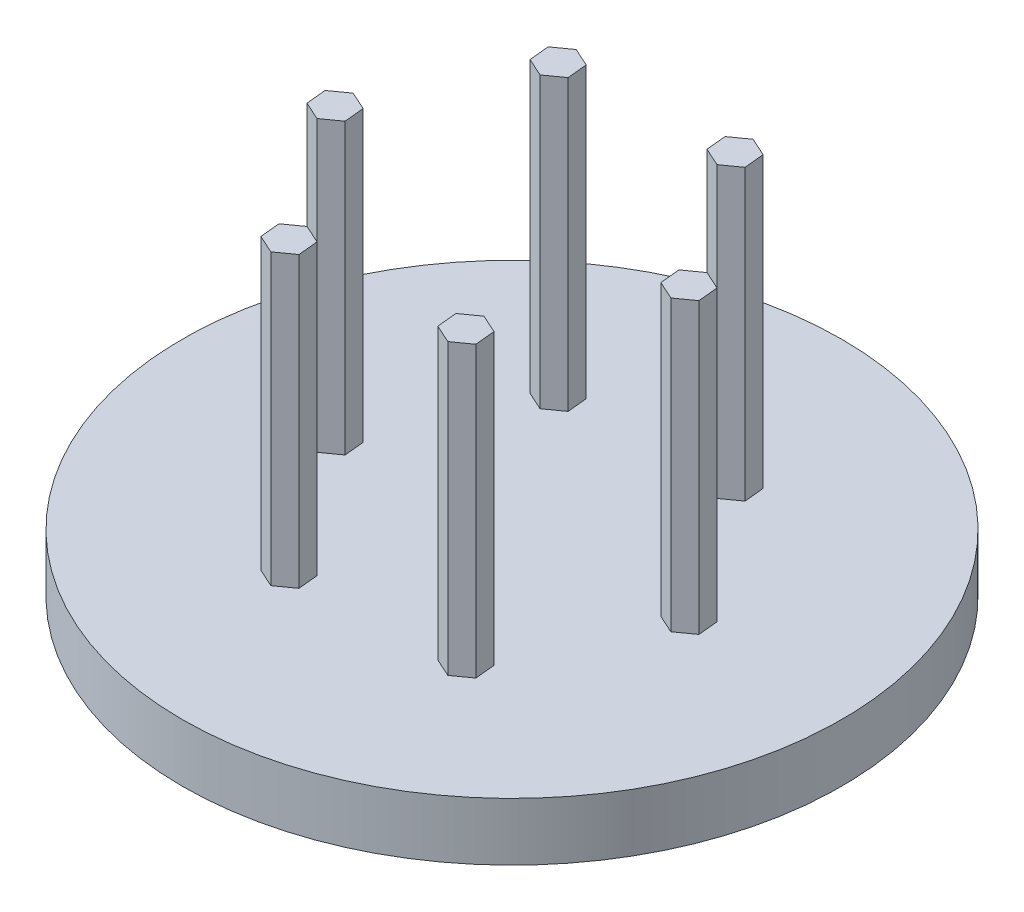
from build123d import *

# Parameters (mm, degrees)
EXTRUDE_1_DEPTH   = 25
EXTRUDE_1_2_DEPTH = 25
EXTRUDE_1_3_DEPTH = 25
EXTRUDE_1_4_DEPTH = 25
EXTRUDE_1_5_DEPTH = 25
EXTRUDE_1_6_DEPTH = 25
SKETCH_2_R        = 28.5
EXTRUDE_2_DEPTH   = 5
EXTRUDE_4_DEPTH   = 5


with BuildPart() as part:
    # 草图1 → 凸台-拉伸1 (new body)
    with BuildSketch(Plane(origin=(0, 0, 0), x_dir=(1, 0, 0), z_dir=(0, 1, 0))):
        Polygon((4.794019272, 13.629956631), (4.962963937, 11.898177863), (6.547200676, 11.178598851), (7.96249275, 12.190798607), (7.793548085, 13.922577374), (6.209311346, 14.642156386), align=None)
    extrude(amount=EXTRUDE_1_DEPTH)



with BuildPart() as body_2:
    # 草图1 → Extrude 1 2 (new body)
    with BuildSketch(Plane(origin=(0, 0, 0), x_dir=(1, 0, 0), z_dir=(0, 1, 0))):
        Polygon((15.954079735, 0.21187806), (15.78513507, 1.943656828), (14.200898331, 2.66323584), (12.785606257, 1.651036084), (12.954550922, -0.080742684), (14.538787661, -0.800321696), align=None)
    extrude(amount=EXTRUDE_1_2_DEPTH)


with BuildPart() as body_3:
    # 草图1 → Extrude 1 3 (new body)
    with BuildSketch(Plane(origin=(0, 0, 0), x_dir=(1, 0, 0), z_dir=(0, 1, 0))):
        Polygon((8.16053165, -13.710699314), (9.575823724, -12.698499559), (9.406879059, -10.966720791), (7.82264232, -10.247141779), (6.407350246, -11.259341535), (6.576294911, -12.991120302), align=None)
    extrude(amount=EXTRUDE_1_3_DEPTH)


with BuildPart() as body_4:
    # 草图1 → Extrude 1 4 (new body)
    with BuildSketch(Plane(origin=(0, 0, 0), x_dir=(1, 0, 0), z_dir=(0, 1, 0))):
        Polygon((-7.793548085, -13.922577374), (-6.209311346, -14.642156386), (-4.794019272, -13.629956631), (-4.962963937, -11.898177863), (-6.547200676, -11.178598851), (-7.96249275, -12.190798607), align=None)
    extrude(amount=EXTRUDE_1_4_DEPTH)


with BuildPart() as body_5:
    # 草图1 → Extrude 1 5 (new body)
    with BuildSketch(Plane(origin=(0, 0, 0), x_dir=(1, 0, 0), z_dir=(0, 1, 0))):
        Polygon((-12.785606257, -1.651036084), (-12.954550922, 0.080742684), (-14.538787661, 0.800321696), (-15.954079735, -0.21187806), (-15.78513507, -1.943656828), (-14.200898331, -2.66323584), align=None)
    extrude(amount=EXTRUDE_1_5_DEPTH)


with BuildPart() as body_6:
    # 草图1 → Extrude 1 6 (new body)
    with BuildSketch(Plane(origin=(0, 0, 0), x_dir=(1, 0, 0), z_dir=(0, 1, 0))):
        Polygon((-6.576294911, 12.991120302), (-8.16053165, 13.710699314), (-9.575823724, 12.698499559), (-9.406879059, 10.966720791), (-7.82264232, 10.247141779), (-6.407350246, 11.259341535), align=None)
    extrude(amount=EXTRUDE_1_6_DEPTH)


with BuildPart() as part_1:
    add(part.part)

    add(body_2.part)  # 凸台-拉伸2 merges body 2

    add(body_3.part)  # 凸台-拉伸2 merges body 3

    add(body_4.part)  # 凸台-拉伸2 merges body 4

    add(body_5.part)  # 凸台-拉伸2 merges body 5

    add(body_6.part)  # 凸台-拉伸2 merges body 6
    # 草图2 → 凸台-拉伸2 (add)
    with BuildSketch(Plane(origin=(0, 0, 0), x_dir=(1, 0, 0), z_dir=(0, 1, 0))):
        with Locations(Location((0, 0, 0), (0, 0, 270))):
            Circle(SKETCH_2_R)
    extrude(amount=-EXTRUDE_2_DEPTH)

    # 草图3 → 凸台-拉伸4 (add)
    with BuildSketch(Plane(origin=(0, -5, 0), x_dir=(-1, 0, 0), z_dir=(0, -1, 0))):
        Polygon((6.067131278, 3.713249853), (8.603282508, 2.334384279), (11.065490739, 3.841322885), (10.991547739, 6.727127065), (8.455396509, 8.105992639), (5.993188279, 6.599054033), align=None)
        Polygon((0, -7.113248654), (-2.5, -8.556624327), (-2.5, -11.443375673), (0, -12.886751346), (2.5, -11.443375673), (2.5, -8.556624327), align=None)
        Polygon((-6.334313735, 3.236475849), (-6.482151211, 6.119439153), (-9.052789409, 7.432889795), (-11.475590131, 5.863377133), (-11.327752654, 2.980413829), (-8.757114457, 1.666963187), align=None)
    extrude(amount=EXTRUDE_4_DEPTH)


solid = part_1.part
